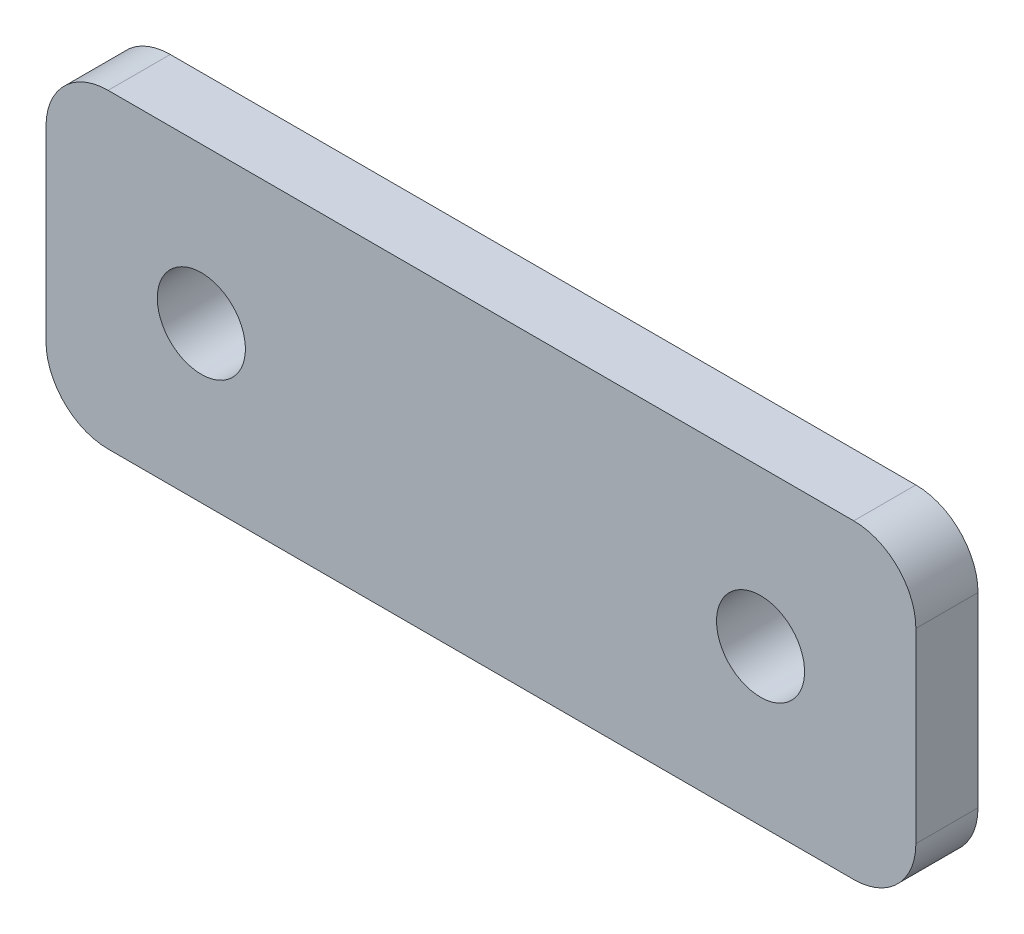
from build123d import *

# Parameters (mm, degrees)
SKETCH1_W            = 44.45
SKETCH1_H            = 15.875
BOSS_EXTRUDE1_DEPTH  = 3.175
M4_CLEARANCE_HOLE1_D = 4.5
FILLET1_R            = 3.175


with BuildPart() as part:
    # Sketch1 → Boss-Extrude1 (new body)
    with BuildSketch(Plane.XY):
        Rectangle(SKETCH1_W, SKETCH1_H)
    extrude(amount=BOSS_EXTRUDE1_DEPTH)

    # M4 Clearance Hole1 (through all)
    with Locations(Plane(origin=(0, 0, 0), x_dir=(-1, 0, 0), z_dir=(0, 0, -1))):
        with Locations((-14.2875, 0), (14.2875, 0)):
            Hole(M4_CLEARANCE_HOLE1_D / 2)

    # Fillet1
    fillet1_edges = [part.edges().sort_by_distance(p)[0] for p in [
        (22.225, -7.9375, 1.5875),
        (-22.225, -7.9375, 1.5875),
        (-22.225, 7.9375, 1.5875),
        (22.225, 7.9375, 1.5875),
    ]]
    fillet(fillet1_edges, radius=FILLET1_R)


solid = part.part
